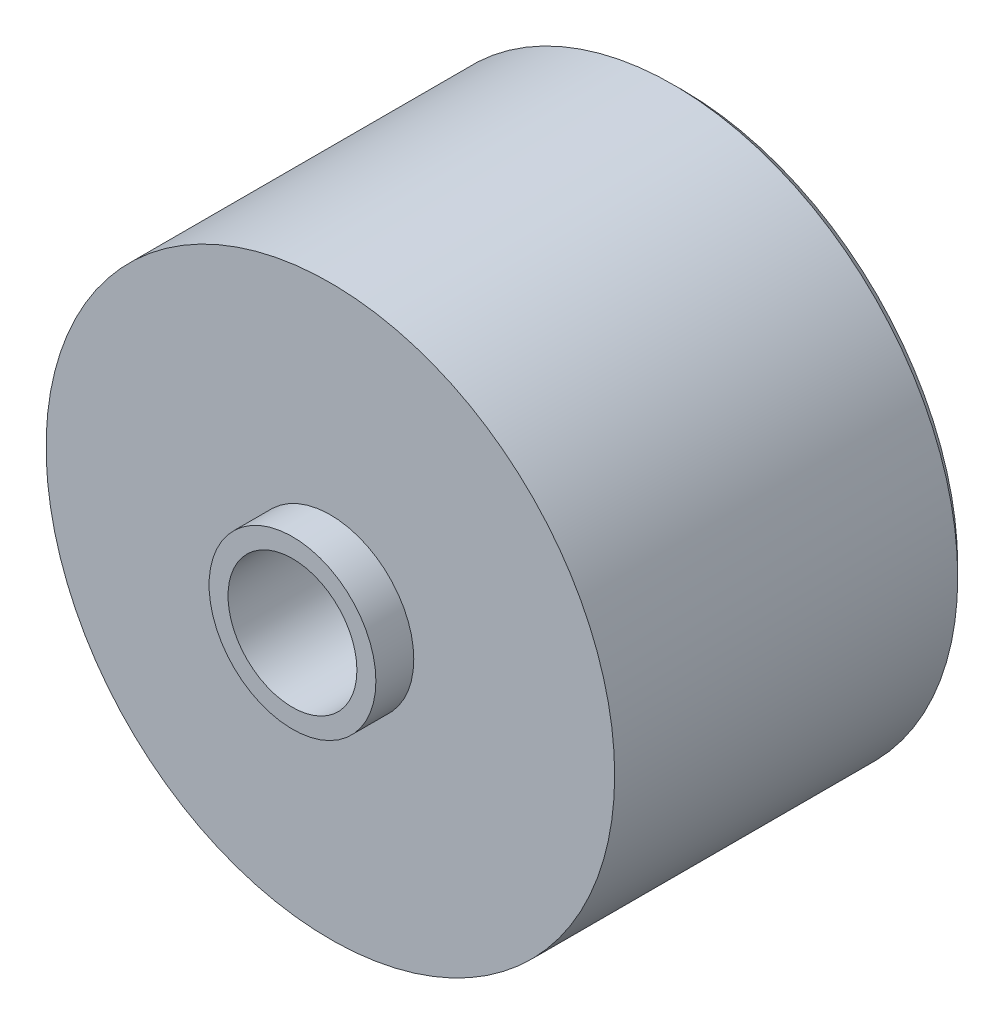
from build123d import *

# Parameters (mm, degrees)
SKETCH1_R           = 7.5
SKETCH1_R_2         = 1.7
BOSS_EXTRUDE1_DEPTH = 9.3
SKETCH2_R           = 2.2
SKETCH2_R_2         = 1.7
BOSS_EXTRUDE2_DEPTH = 1
CHAMFER1_SIZE       = 0.25


with BuildPart() as part:
    # Sketch1 → Boss-Extrude1 (new body)
    with BuildSketch(Plane.XY):
        Circle(SKETCH1_R)
        Circle(SKETCH1_R_2, mode=Mode.SUBTRACT)
    extrude(amount=BOSS_EXTRUDE1_DEPTH)

    # Sketch2 → Boss-Extrude2 (add)
    with BuildSketch(Plane.XY.offset(9.3)):
        Circle(SKETCH2_R)
        Circle(SKETCH2_R_2, mode=Mode.SUBTRACT)
    extrude(amount=BOSS_EXTRUDE2_DEPTH)

    # Chamfer1
    chamfer1_edges = [part.edges().sort_by_distance(p)[0] for p in [
        (-7.5, 0, 0),
        (-1.7, 0, 0),
    ]]
    chamfer(chamfer1_edges, length=CHAMFER1_SIZE)


solid = part.part
